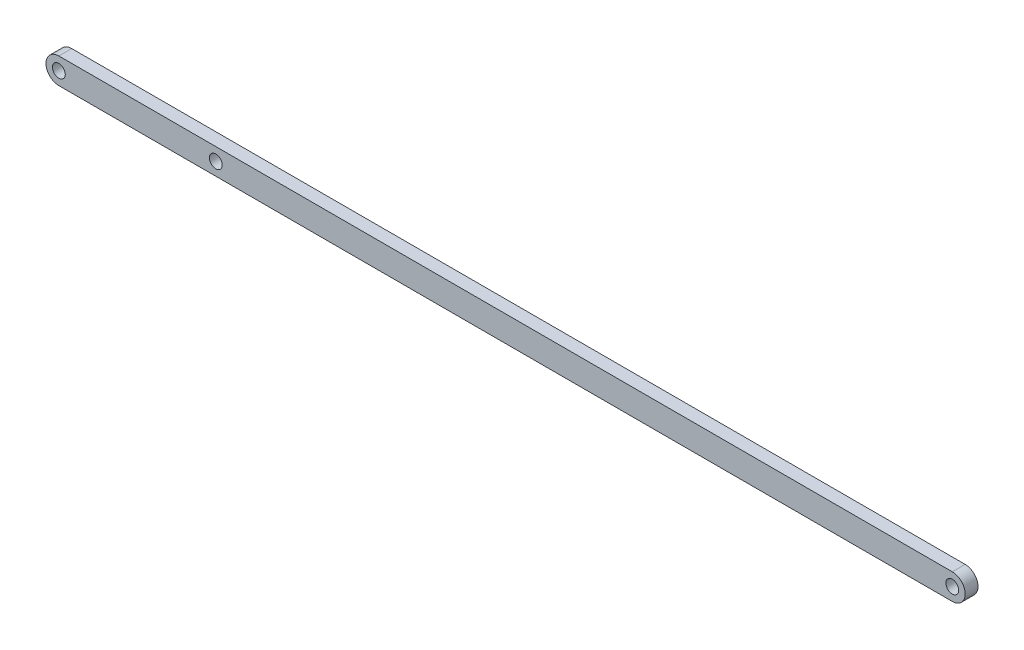
from build123d import *

# Parameters (mm, degrees)
ESBO_O1_R                = 2.5
RESSALTO_EXTRUS_O1_DEPTH = 5


with BuildPart() as part:
    # Esboço1 → Ressalto-extrusão1 (new body)
    with BuildSketch(Plane.XY):
        with BuildLine():
            Line((173.74, 5), (-173.74, 5))
            ThreePointArc((-173.74, 5), (-178.74, 0), (-173.74, -5))
            Line((-173.74, -5), (173.74, -5))
            ThreePointArc((173.74, -5), (178.74, 0), (173.74, 5))
        make_face()
        with Locations((-173.74, 0)):
            Circle(ESBO_O1_R, mode=Mode.SUBTRACT)
        with Locations((173.74, 0)):
            Circle(ESBO_O1_R, mode=Mode.SUBTRACT)
        with Locations((-112.7, 0)):
            Circle(ESBO_O1_R, mode=Mode.SUBTRACT)
    extrude(amount=RESSALTO_EXTRUS_O1_DEPTH)


solid = part.part
